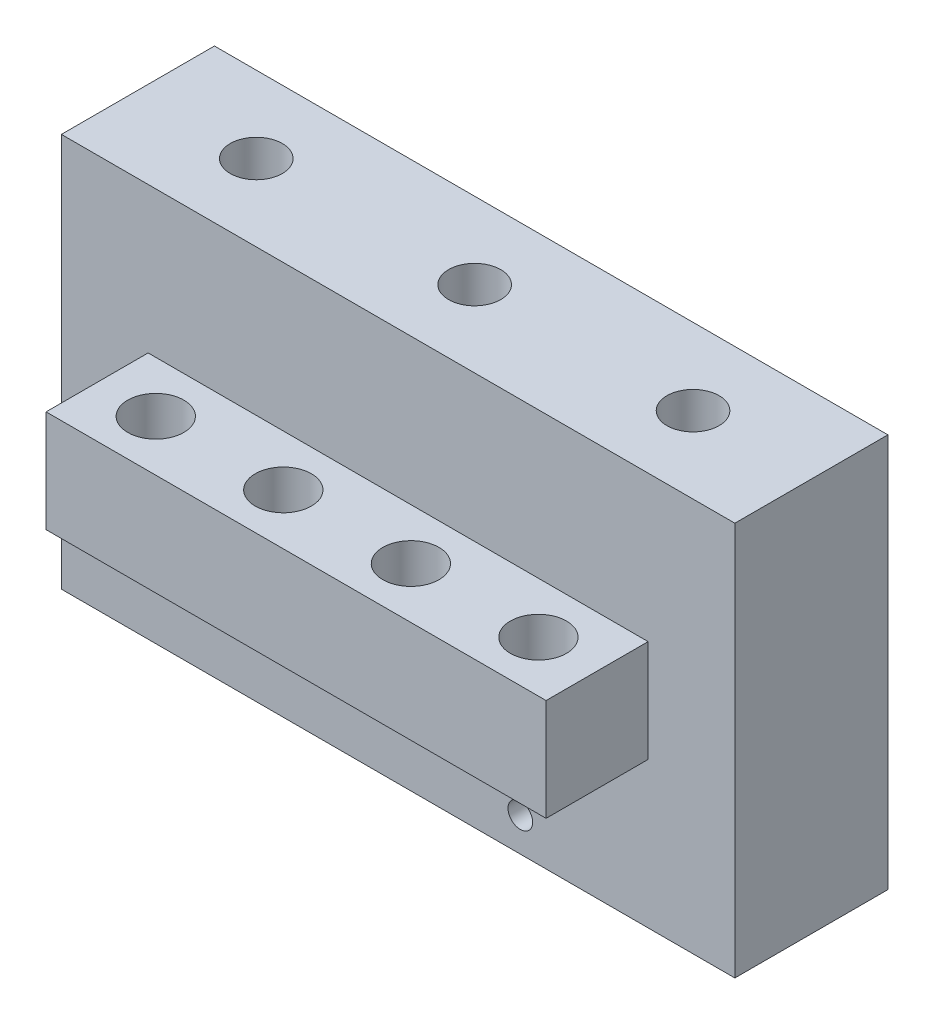
from build123d import *

# Parameters (mm, degrees)
SKETCH1_W                         = 49
SKETCH1_H                         = 10
BOSS_EXTRUDE1_DEPTH               = 10
SKETCH2_R                         = 2.75
CUT_EXTRUDE1_DEPTH                = 29.28869032
SKETCH3_W                         = 66
SKETCH3_H                         = 25
BOSS_EXTRUDE2_DEPTH               = 15
SKETCH11_W                        = 66
SKETCH11_H                        = 25
BOSS_EXTRUDE3_DEPTH               = 15
F_1_4_20_TAPPED_HOLE1_D           = 5.1054
F_1_4_20_TAPPED_HOLE2_D           = 5.1054
SKETCH17_RX                       = 1.2065
SKETCH17_RY                       = 1.205867042
TORSIONAL_SPRING_MOUNT_HOLE_DEPTH = 49.005103895


with BuildPart() as part:
    # Sketch1 → Boss-Extrude1 (new body)
    with BuildSketch(Plane(origin=(0, 0, 0), x_dir=(1, 0, 0), z_dir=(0, 1, 0))):
        with Locations((0, 5)):
            Rectangle(SKETCH1_W, SKETCH1_H)
    extrude(amount=BOSS_EXTRUDE1_DEPTH)

    # Sketch2 → Cut-Extrude1 (cut, through all)
    with BuildSketch(Plane(origin=(0, 10, 0), x_dir=(1, 0, 0), z_dir=(0, 1, 0))):
        with Locations(Location((-18.75, 5, 0), (0, 0, 270))):
            Circle(SKETCH2_R)
        with Locations(Location((-6.25, 5, 0), (0, 0, 270))):
            Circle(SKETCH2_R)
        with Locations(Location((6.25, 5, 0), (0, 0, 270))):
            Circle(SKETCH2_R)
        with Locations(Location((18.75, 5, 0), (0, 0, 270))):
            Circle(SKETCH2_R)
    extrude(amount=-CUT_EXTRUDE1_DEPTH, mode=Mode.SUBTRACT)

    # Sketch3 → Boss-Extrude2 (add)
    with BuildSketch(Plane(origin=(0, 0, -10), x_dir=(-1, 0, 0), z_dir=(0, 0, -1))):
        with Locations((0, 5)):
            Rectangle(SKETCH3_W, SKETCH3_H)
    extrude(amount=BOSS_EXTRUDE2_DEPTH)

    # Sketch11 → Boss-Extrude3 (add)
    with BuildSketch(Plane(origin=(0, 0, -25), x_dir=(-1, 0, 0), z_dir=(0, 0, -1))):
        with Locations((0, 5)):
            Rectangle(SKETCH11_W, SKETCH11_H)
        Polygon((33, -7.5), (-33, -7.5), (-33, -14.300000001), (-7.8, -14.300000001), (7.8, -14.300000001), (33, -14.300000001), align=None)
        Polygon((-33, 24.299999999), (-33, 17.5), (33, 17.5), (33, 24.299999999), (7.8, 24.299999999), (-7.8, 24.299999999), align=None)
    extrude(amount=-BOSS_EXTRUDE3_DEPTH)

    # 1/4-20 Tapped Hole1 (through all)
    with Locations(Plane(origin=(0, -14.300000001, 0), x_dir=(-1, 0, 0), z_dir=(0, -1, 0))):
        with Locations((0, 17.5)):
            Hole(F_1_4_20_TAPPED_HOLE1_D / 2)

    # 1/4-20 Tapped Hole2 (through all)
    with Locations(Plane(origin=(0, -14.300000001, 0), x_dir=(-1, 0, 0), z_dir=(0, -1, 0))):
        with Locations((21.4, 17.5), (-21.4, 17.5)):
            Hole(F_1_4_20_TAPPED_HOLE2_D / 2)

    # Sketch17 → Torsional Spring Mount Hole (cut, through all)
    with BuildSketch(Plane(origin=(0, 0, -25), x_dir=(-1, 0, 0), z_dir=(0, 0, -1))):
        with Locations((-11.9761, -11.000000001)):
            Ellipse(SKETCH17_RX, SKETCH17_RY)
    extrude(amount=-TORSIONAL_SPRING_MOUNT_HOLE_DEPTH, mode=Mode.SUBTRACT)


solid = part.part
